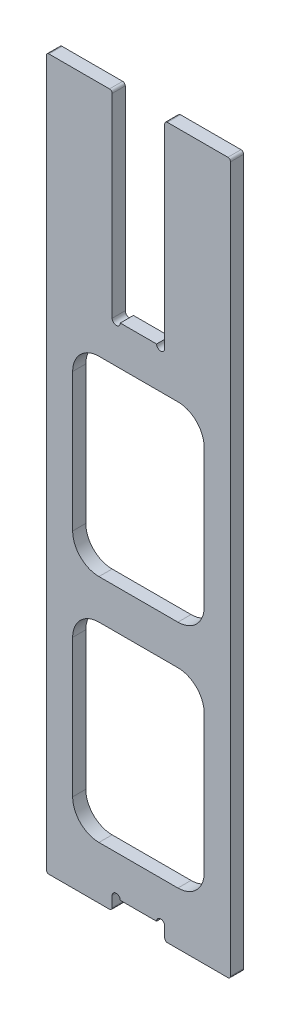
from build123d import *

# Parameters (mm, degrees)
SKETCH_1_W          = 25
SKETCH_1_H          = 5
SKETCH_1_W_2        = 70
SKETCH_1_H_2        = 190
EXTRUDE_1_DEPTH     = 5
SKETCH_2_R          = 1.55
CUT_EXTRUDE_1_DEPTH = 5
SKETCH_3_W          = 25
SKETCH_3_H          = 70
EXTRUDE_2_DEPTH     = 5
SKETCH_4_W          = 50
SKETCH_4_H          = 72.5
CUT_EXTRUDE_2_DEPTH = 5
FILLET_1_R          = 10
FILLET_2_R          = 1


with BuildPart() as part:
    # 草图1 → 凸台-拉伸1 (new body)
    with BuildSketch(Plane.XY):
        with Locations((57.5, 192.5)):
            Rectangle(SKETCH_1_W, SKETCH_1_H)
        with Locations((35, 95)):
            Rectangle(SKETCH_1_W_2, SKETCH_1_H_2)
        with Locations((12.5, 192.5)):
            Rectangle(SKETCH_1_W, SKETCH_1_H)
        with Locations((57.5, -2.5)):
            Rectangle(SKETCH_1_W, SKETCH_1_H)
        with Locations((12.5, -2.5)):
            Rectangle(SKETCH_1_W, SKETCH_1_H)
    extrude(amount=EXTRUDE_1_DEPTH)

    # 草图2 → 切除-拉伸1 (cut)
    with BuildSketch(Plane.XY.offset(5)):
        with Locations((43.45, 0)):
            Circle(SKETCH_2_R)
        with Locations((26.55, 0)):
            Circle(SKETCH_2_R)
        with Locations((43.45, 190)):
            Circle(SKETCH_2_R)
        with Locations((26.55, 190)):
            Circle(SKETCH_2_R)
    extrude(amount=-CUT_EXTRUDE_1_DEPTH, mode=Mode.SUBTRACT)

    # 草图3 → 凸台-拉伸2 (add)
    with BuildSketch(Plane.XY.offset(5)):
        with Locations((12.5, 230)):
            Rectangle(SKETCH_3_W, SKETCH_3_H)
        with Locations((57.5, 230)):
            Rectangle(SKETCH_3_W, SKETCH_3_H)
    extrude(amount=-EXTRUDE_2_DEPTH)

    # 草图4 → 切除-拉伸2 (cut)
    with BuildSketch(Plane.XY.offset(5)):
        with Locations((35, 138.75)):
            Rectangle(SKETCH_4_W, SKETCH_4_H)
        with Locations((35, 51.25)):
            Rectangle(SKETCH_4_W, SKETCH_4_H)
    extrude(amount=-CUT_EXTRUDE_2_DEPTH, mode=Mode.SUBTRACT)

    # 圆角1
    fillet_1_edges = [part.edges().sort_by_distance(p)[0] for p in [
        (10, 15, 2.5),
        (10, 87.5, 2.5),
        (60, 87.5, 2.5),
        (60, 15, 2.5),
        (60, 102.5, 2.5),
        (10, 102.5, 2.5),
        (10, 175, 2.5),
        (60, 175, 2.5),
    ]]
    fillet(fillet_1_edges, radius=FILLET_1_R)

    # 圆角2
    fillet_2_edges = [part.edges().sort_by_distance(p)[0] for p in [
        (70, -5, 2.5),
        (45, -5, 2.5),
        (25, -5, 2.5),
        (0, -5, 2.5),
        (25, 265, 2.5),
        (0, 265, 2.5),
        (70, 265, 2.5),
        (45, 265, 2.5),
    ]]
    fillet(fillet_2_edges, radius=FILLET_2_R)


solid = part.part
